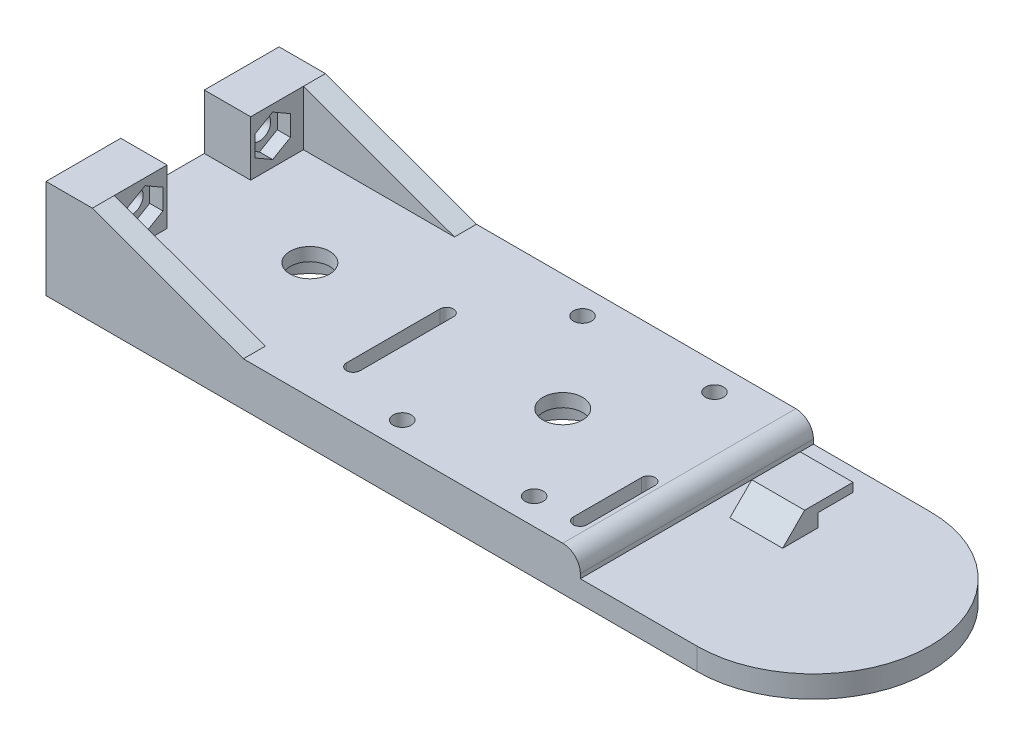
from build123d import *

# Parameters (mm, degrees)
BOSS_EXTRUDE1_DEPTH = 10
SKETCH2_W           = 10.53641682
SKETCH2_H           = 17
BOSS_EXTRUDE2_DEPTH = 12.5
RIB1_REACH          = 117.825
SKETCH3_WALL_W      = 270.198153966
SKETCH3_WALL_H      = 5
CUT_EXTRUDE1_REACH  = 169.608
SKETCH4_R           = 2.55
CUT_EXTRUDE2_DEPTH  = 3
SKETCH6_R           = 11.1
CUT_EXTRUDE3_DEPTH  = 7
CUT_EXTRUDE5_REACH  = 107.084
SKETCH8_R           = 4.5
SKETCH9_R           = 11.1
CUT_EXTRUDE6_DEPTH  = 7
CUT_EXTRUDE7_REACH  = 107.084
SKETCH10_R          = 4.5
SKETCH12_R          = 2.05
CUT_EXTRUDE9_DEPTH  = 105.684048451
CUT_EXTRUDE10_DEPTH = 3
CUT_EXTRUDE11_REACH = 108.343
CUT_EXTRUDE12_REACH = 108.343
SKETCH16_W          = 53
SKETCH16_H          = 93.98301549
CUT_EXTRUDE13_DEPTH = 5
FILLET3_R           = 4
SKETCH17_W          = 12
SKETCH17_H          = 3
BOSS_EXTRUDE3_DEPTH = 5
SKETCH18_W          = 12
SKETCH18_H          = 2
BOSS_EXTRUDE4_DEPTH = 8
RIB2_REACH          = 144.796
SKETCH19_WALL_W     = 294.663434656
SKETCH19_WALL_H     = 12


with BuildPart() as part:
    # Sketch1 → Boss-Extrude1 (new body)
    with BuildSketch(Plane(origin=(0, 0, 0), x_dir=(1, 0, 0), z_dir=(0, 1, 0))):
        with BuildLine():
            Line((-74, 26.5), (74, 26.5))
            ThreePointArc((74, 26.5), (100.5, 0), (74, -26.5))
            Line((74, -26.5), (-74, -26.5))
            Line((-74, -26.5), (-74, 26.5))
        make_face()
    extrude(amount=BOSS_EXTRUDE1_DEPTH)

    # Sketch2 → Boss-Extrude2 (add)
    with BuildSketch(Plane(origin=(0, 10, 0), x_dir=(1, 0, 0), z_dir=(0, 1, 0))):
        with Locations((-68.73179159, -18)):
            Rectangle(SKETCH2_W, SKETCH2_H)
    boss_extrude2 = extrude(amount=BOSS_EXTRUDE2_DEPTH)

    # Sketch3 wall → Rib1 (add, up to next)
    with BuildSketch(Plane(origin=(-46.291849308, 16.25, 26.5), x_dir=(0.939692620789, -0.342020143318, 0), z_dir=(0.342020143318, 0.939692620789, 0)), mode=Mode.PRIVATE) as rib1_sk1:
        with Locations((0, 2.5)):
            Rectangle(SKETCH3_WALL_W, SKETCH3_WALL_H)
    rib1_tool1 = extrude(rib1_sk1.sketch, amount=-RIB1_REACH, mode=Mode.PRIVATE) - part.part
    rib1 = rib1_tool1.solids().sort_by_distance((-46.291849308, 16.25, 26.5))[0]
    add(rib1)

    # Sketch4 → Cut-Extrude1 (cut, up to next)
    with BuildSketch(Plane(origin=(-63.46358318, 0, 0), x_dir=(0, 0, -1), z_dir=(1, 0, 0)), mode=Mode.PRIVATE) as cut_extrude1_sk1:
        with Locations((-14.5, 16.25)):
            Circle(SKETCH4_R)
    cut_extrude1_tool1 = extrude(cut_extrude1_sk1.sketch, amount=-CUT_EXTRUDE1_REACH, mode=Mode.PRIVATE) & part.part
    cut_extrude1 = cut_extrude1_tool1.solids().sort_by_distance((-63.463583, 16.25, 14.5))[0]
    add(cut_extrude1, mode=Mode.SUBTRACT)

    # Sketch5 → Cut-Extrude2 (cut)
    with BuildSketch(Plane(origin=(-63.46358318, 0, 0), x_dir=(0, 0, -1), z_dir=(1, 0, 0))):
        Polygon((-10.45, 13.91173141), (-10.45, 18.58826859), (-14.5, 20.92653718), (-18.55, 18.58826859), (-18.55, 13.91173141), (-14.5, 11.57346282), align=None)
    cut_extrude2 = extrude(amount=-CUT_EXTRUDE2_DEPTH, mode=Mode.SUBTRACT)

    # Mirror1: Boss-Extrude2, Rib1, Cut-Extrude1, Cut-Extrude2 across plane
    add(boss_extrude2.mirror(Plane.XY))
    add(rib1.mirror(Plane.XY))
    add(cut_extrude1.mirror(Plane.XY), mode=Mode.SUBTRACT)
    add(cut_extrude2.mirror(Plane.XY), mode=Mode.SUBTRACT)

    # Sketch6 → Cut-Extrude3 (cut)
    with BuildSketch(Plane.XZ):
        with Locations(Location((-40.5, 0, 0), (0, 0, 270))):
            Circle(SKETCH6_R)
    extrude(amount=-CUT_EXTRUDE3_DEPTH, mode=Mode.SUBTRACT)

    # Sketch8 → Cut-Extrude5 (cut, up to next)
    with BuildSketch(Plane.XZ.offset(-7), mode=Mode.PRIVATE) as cut_extrude5_sk1:
        with Locations(Location((-40.5, 0, 0), (0, 0, 270))):
            Circle(SKETCH8_R)
    cut_extrude5_tool1 = extrude(cut_extrude5_sk1.sketch, amount=-CUT_EXTRUDE5_REACH, mode=Mode.PRIVATE) & part.part
    add(cut_extrude5_tool1.solids().sort_by_distance((-40.5, 7, 0))[0], mode=Mode.SUBTRACT)

    # Sketch9 → Cut-Extrude6 (cut)
    with BuildSketch(Plane.XZ):
        with Locations(Location((17, 0, 0), (0, 0, 270))):
            Circle(SKETCH9_R)
    extrude(amount=-CUT_EXTRUDE6_DEPTH, mode=Mode.SUBTRACT)

    # Sketch10 → Cut-Extrude7 (cut, up to next)
    with BuildSketch(Plane.XZ.offset(-7), mode=Mode.PRIVATE) as cut_extrude7_sk1:
        with Locations(Location((17, 0, 0), (0, 0, 270))):
            Circle(SKETCH10_R)
    cut_extrude7_tool1 = extrude(cut_extrude7_sk1.sketch, amount=-CUT_EXTRUDE7_REACH, mode=Mode.PRIVATE) & part.part
    add(cut_extrude7_tool1.solids().sort_by_distance((17, 7, 0))[0], mode=Mode.SUBTRACT)

    # Sketch12 → Cut-Extrude9 (cut, through all)
    with BuildSketch(Plane(origin=(0, 10, 0), x_dir=(1, 0, 0), z_dir=(0, 1, 0))):
        with Locations(Location((1, 20.5, 0), (0, 0, 270))):
            Circle(SKETCH12_R)
        with Locations(Location((31, 20.5, 0), (0, 0, 270))):
            Circle(SKETCH12_R)
    cut_extrude9 = extrude(amount=-CUT_EXTRUDE9_DEPTH, mode=Mode.SUBTRACT)

    # Sketch13 → Cut-Extrude10 (cut)
    with BuildSketch(Plane.XZ):
        Polygon((4.64766982, -22.61135933), (4.652325726, -18.396704937), (1.004655907, -16.285345607), (-2.64766982, -18.38864067), (-2.652325726, -22.603295063), (0.995344093, -24.714654393), align=None)
        Polygon((34.557933518, -22.759301311), (34.735579089, -18.548389844), (31.177645571, -16.289088533), (27.442066482, -18.240698689), (27.264420911, -22.451610156), (30.822354429, -24.710911467), align=None)
    cut_extrude10 = extrude(amount=-CUT_EXTRUDE10_DEPTH, mode=Mode.SUBTRACT)

    # Mirror2: Cut-Extrude9, Cut-Extrude10 across plane
    add(cut_extrude9.mirror(Plane.XY), mode=Mode.SUBTRACT)
    add(cut_extrude10.mirror(Plane.XY), mode=Mode.SUBTRACT)

    # Sketch14 → Cut-Extrude11 (cut, up to next)
    with BuildSketch(Plane.XZ, mode=Mode.PRIVATE) as cut_extrude11_sk1:
        with BuildLine():
            Line((-13.507595269, 15.569177398), (-13.507595269, -5.661519054))
            ThreePointArc((-13.507595269, -5.661519054), (-15.057595269, -7.211519054), (-16.607595269, -5.661519054))
            Line((-16.607595269, -5.661519054), (-16.607595269, 15.569177398))
            ThreePointArc((-16.607595269, 15.569177398), (-15.057595269, 17.119177398), (-13.507595269, 15.569177398))
        make_face()
    cut_extrude11_tool1 = extrude(cut_extrude11_sk1.sketch, amount=-CUT_EXTRUDE11_REACH, mode=Mode.PRIVATE) & part.part
    add(cut_extrude11_tool1.solids().sort_by_distance((-15.057595, 0, 4.953829))[0], mode=Mode.SUBTRACT)

    # Sketch15 → Cut-Extrude12 (cut, up to next)
    with BuildSketch(Plane.XZ, mode=Mode.PRIVATE) as cut_extrude12_sk1:
        with BuildLine():
            Line((42.621659424, 20.124694382), (42.621659424, 4.616853199))
            ThreePointArc((42.621659424, 4.616853199), (41.071659424, 3.066853199), (39.521659424, 4.616853199))
            Line((39.521659424, 4.616853199), (39.521659424, 20.124694382))
            ThreePointArc((39.521659424, 20.124694382), (41.071659424, 21.674694382), (42.621659424, 20.124694382))
        make_face()
    cut_extrude12_tool1 = extrude(cut_extrude12_sk1.sketch, amount=-CUT_EXTRUDE12_REACH, mode=Mode.PRIVATE) & part.part
    add(cut_extrude12_tool1.solids().sort_by_distance((41.071659, 0, 12.370774))[0], mode=Mode.SUBTRACT)

    # Sketch16 → Cut-Extrude13 (cut)
    with BuildSketch(Plane(origin=(0, 10, 0), x_dir=(1, 0, 0), z_dir=(0, 1, 0))):
        with Locations((74, 0)):
            Rectangle(SKETCH16_W, SKETCH16_H)
    extrude(amount=-CUT_EXTRUDE13_DEPTH, mode=Mode.SUBTRACT)

    # Fillet3
    fillet3_edges = [part.edges().sort_by_distance(p)[0] for p in [
        (47.5, 10, 0),
    ]]
    fillet(fillet3_edges, radius=FILLET3_R)

    # Sketch17 → Boss-Extrude3 (add)
    with BuildSketch(Plane(origin=(0, 5, 0), x_dir=(1, 0, 0), z_dir=(0, 1, 0))):
        with Locations((58.5, 9)):
            Rectangle(SKETCH17_W, SKETCH17_H)
    extrude(amount=BOSS_EXTRUDE3_DEPTH)

    # Sketch18 → Boss-Extrude4 (add)
    with BuildSketch(Plane(origin=(0, 0, -10.5), x_dir=(-1, 0, 0), z_dir=(0, 0, -1))):
        with Locations((-58.5, 9)):
            Rectangle(SKETCH18_W, SKETCH18_H)
    extrude(amount=BOSS_EXTRUDE4_DEPTH)

    # Sketch19 wall → Rib2 (add, up to next)
    with BuildSketch(Plane(origin=(64.5, 7.5, -5), x_dir=(0, -0.707106781187, 0.707106781187), z_dir=(0, -0.707106781187, -0.707106781187)), mode=Mode.PRIVATE) as rib2_sk1:
        with Locations((0, 6)):
            Rectangle(SKETCH19_WALL_W, SKETCH19_WALL_H)
    rib2_tool1 = extrude(rib2_sk1.sketch, amount=RIB2_REACH, mode=Mode.PRIVATE) - part.part
    add(rib2_tool1.solids().sort_by_distance((64.5, 7.5, -5))[0])


solid = part.part
